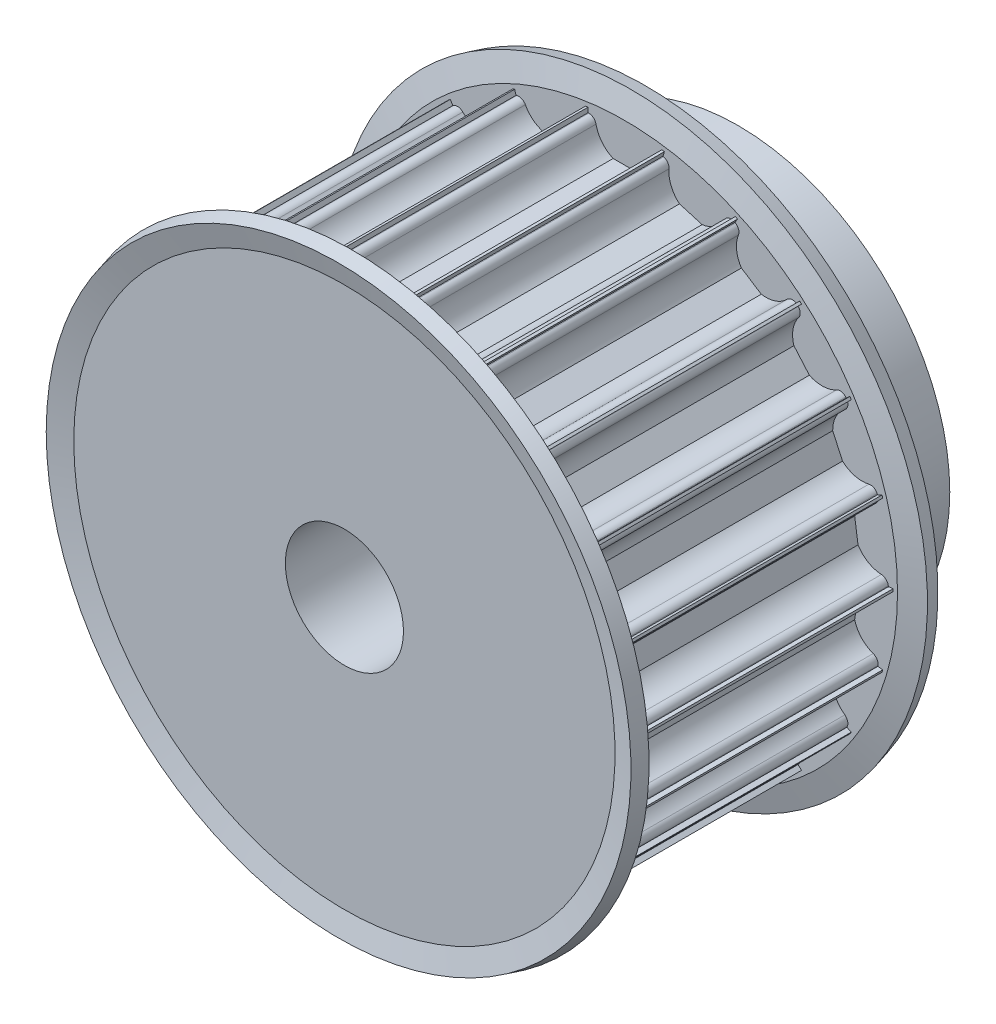
from build123d import *

# Parameters (mm, degrees)
CUT_EXTRUDE1_REACH = 57.544
CIRPATTERN1_COUNT  = 22


with BuildPart() as part:
    # Sketch2 → Revolve1 (revolve)
    with BuildSketch(Plane(origin=(0, 0, 0), x_dir=(0, 0, -1), z_dir=(1, 0, 0)), mode=Mode.PRIVATE) as revolve1_sk:
        Polygon((0, 6), (40, 6), (40, 21.5), (30, 21.5), (30, 27.25), (0, 27.25), align=None)
    revolve(revolve1_sk.sketch.rotate(Axis((0, 0, 0), (0, 0, -1)), 90), axis=Axis((0, 0, 0), (0, 0, -1)))

    # Sketch3 → Cut-Extrude1 (cut, up to next)
    with BuildSketch(Plane.XY, mode=Mode.PRIVATE) as cut_extrude1_sk1:
        with BuildLine():
            Line((-3.674234614, 26.5), (-3.75, 26.5))
            Line((-3.75, 26.5), (-3.75, 28.5))
            Line((-3.75, 28.5), (3.75, 28.5))
            Line((3.75, 28.5), (3.75, 26.5))
            Line((3.75, 26.5), (3.674234614, 26.5))
            ThreePointArc((3.674234614, 26.5), (3.199892965, 26.330947502), (2.939387691, 25.9))
            ThreePointArc((2.939387691, 25.9), (2.331759211, 24.612435701), (1.198957881, 23.75))
            Line((1.198957881, 23.75), (-1.198957881, 23.75))
            ThreePointArc((-1.198957881, 23.75), (-2.331759211, 24.612435701), (-2.939387691, 25.9))
            ThreePointArc((-2.939387691, 25.9), (-3.199892965, 26.330947502), (-3.674234614, 26.5))
        make_face()
    cut_extrude1_tool1 = extrude(cut_extrude1_sk1.sketch, amount=-CUT_EXTRUDE1_REACH, mode=Mode.PRIVATE) & part.part
    cut_extrude1 = cut_extrude1_tool1.solids().sort_by_distance((0, 26.435169, 0))[0]
    add(cut_extrude1, mode=Mode.SUBTRACT)

    # CirPattern1: Cut-Extrude1 ×22 about axis
    cirpattern1_axis = Axis((0, 0, 0), (0, 0, 1))
    for i in range(1, CIRPATTERN1_COUNT):
        add(cut_extrude1.rotate(cirpattern1_axis, i * 360 / CIRPATTERN1_COUNT), mode=Mode.SUBTRACT)

    # Sketch4 → Revolve2 (revolve)
    with BuildSketch(Plane(origin=(0, 0, 0), x_dir=(0, 0, -1), z_dir=(1, 0, 0)), mode=Mode.PRIVATE) as revolve2_sk:
        Polygon((30, 21.5), (30, 27.492521254), (30.591966801, 29.701771432), (29.143078062, 30.09), (28.5, 27.69), (28.5, 21.5), align=None)
        Polygon((1.5, 21.5), (0, 21.5), (0, 27.492521254), (-0.591966801, 29.701771432), (0.856921938, 30.09), (1.5, 27.69), align=None)
    revolve(revolve2_sk.sketch.rotate(Axis((0, 0, 0), (0, 0, 1)), 90), axis=Axis((0, 0, 0), (0, 0, 1)))


solid = part.part
